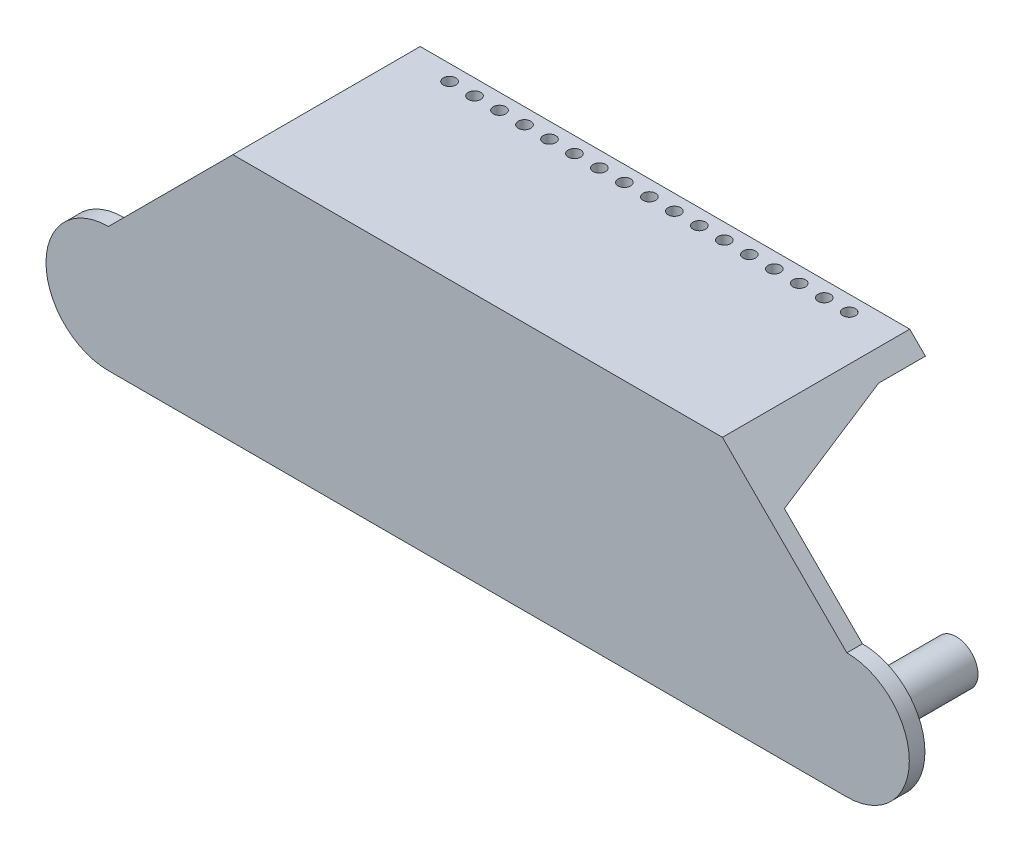
from build123d import *

# Parameters (mm, degrees)
EXTRUDE_1_DEPTH          = 5
SKETCH_2_R               = 7
EXTRUDE_2_DEPTH          = 30
EXTRUDE_3_DEPTH          = 5
EXTRUDE_4_DEPTH          = 55
SKETCH_5_R               = 2
CUT_EXTRUDE_1_DEPTH      = 169.861141178
EXTRUDE_5_DEPTH          = 40
CUT_EXTRUDE_2_DEPTH      = 161.374826578
CUT_EXTRUDE_2_DEPTH_BACK = 161.374826578


with BuildPart() as part:
    # Эскиз1 → Бобышка-Вытянуть1 (new body)
    with BuildSketch(Plane.XY):
        with BuildLine():
            Line((-118.25, -20), (118.25, -20))
            ThreePointArc((118.25, -20), (138.25, 0), (118.25, 20))
            Line((118.25, 20), (-118.25, 20))
            ThreePointArc((-118.25, 20), (-138.25, 0), (-118.25, -20))
        make_face()
    extrude(amount=EXTRUDE_1_DEPTH)

    # Эскиз2 → Бобышка-Вытянуть2 (add)
    with BuildSketch(Plane(origin=(0, 0, 0), x_dir=(-1, 0, 0), z_dir=(0, 0, -1))):
        with Locations(Location((-118.25, 0, 0), (0, 0, 180))):
            Circle(SKETCH_2_R)
        with Locations(Location((118.25, 0, 0), (0, 0, 180))):
            Circle(SKETCH_2_R)
    extrude(amount=EXTRUDE_2_DEPTH)

    # Эскиз3 → Бобышка-Вытянуть3 (add)
    with BuildSketch(Plane.XY.offset(5)):
        Polygon((-118.25, 20), (-78.4, 59.85), (78.4, 59.85), (118.25, 20), align=None)
    extrude(amount=-EXTRUDE_3_DEPTH)

    # Эскиз4 → Бобышка-Вытянуть4 (add)
    with BuildSketch(Plane(origin=(0, 0, 0), x_dir=(-1, 0, 0), z_dir=(0, 0, -1))):
        Polygon((-78.4, 59.85), (-83.4, 54.85), (83.4, 54.85), (78.4, 59.85), align=None)
    extrude(amount=EXTRUDE_4_DEPTH)

    # Эскиз5 → Вырез-Вытянуть1 (cut, through all)
    with BuildSketch(Plane(origin=(0, 59.85, 0), x_dir=(1, 0, 0), z_dir=(0, 1, 0))):
        with Locations(Location((0, 50, 0), (0, 0, 180))):
            Circle(SKETCH_5_R)
        with Locations(Location((8, 50, 0), (0, 0, 180))):
            Circle(SKETCH_5_R)
        with Locations(Location((16, 50, 0), (0, 0, 180))):
            Circle(SKETCH_5_R)
        with Locations(Location((24, 50, 0), (0, 0, 180))):
            Circle(SKETCH_5_R)
        with Locations(Location((32, 50, 0), (0, 0, 180))):
            Circle(SKETCH_5_R)
        with Locations(Location((40, 50, 0), (0, 0, 180))):
            Circle(SKETCH_5_R)
        with Locations(Location((48, 50, 0), (0, 0, 180))):
            Circle(SKETCH_5_R)
        with Locations(Location((56, 50, 0), (0, 0, 180))):
            Circle(SKETCH_5_R)
        with Locations(Location((64, 50, 0), (0, 0, 180))):
            Circle(SKETCH_5_R)
        with Locations(Location((-8, 50, 0), (0, 0, 180))):
            Circle(SKETCH_5_R)
        with Locations(Location((-16, 50, 0), (0, 0, 180))):
            Circle(SKETCH_5_R)
        with Locations(Location((-24, 50, 0), (0, 0, 180))):
            Circle(SKETCH_5_R)
        with Locations(Location((-32, 50, 0), (0, 0, 180))):
            Circle(SKETCH_5_R)
        with Locations(Location((-40, 50, 0), (0, 0, 180))):
            Circle(SKETCH_5_R)
        with Locations(Location((-48, 50, 0), (0, 0, 180))):
            Circle(SKETCH_5_R)
        with Locations(Location((-56, 50, 0), (0, 0, 180))):
            Circle(SKETCH_5_R)
        with Locations(Location((-64, 50, 0), (0, 0, 180))):
            Circle(SKETCH_5_R)
    extrude(amount=-CUT_EXTRUDE_1_DEPTH, mode=Mode.SUBTRACT)

    # Эскиз7 → Бобышка-Вытянуть5 (add)
    with BuildSketch(Plane(origin=(0, 0, 0), x_dir=(-1, 0, 0), z_dir=(0, 0, -1))):
        Polygon((-118.25, 20), (-111.178932188, 20), (-76.04842613, 55.130506058), (-83.4, 54.85), align=None)
        Polygon((83.4, 54.85), (76.328932188, 54.85), (111.178932188, 20), (118.25, 20), align=None)
    extrude(amount=EXTRUDE_5_DEPTH)

    # Эскиз10 → Вырез-Вытянуть2 (cut, two sides: drawn at the far end of the back side and taken through both)
    with BuildSketch(Plane(origin=(0, 0, 0), x_dir=(0, 0, -1), z_dir=(1, 0, 0)).offset(-CUT_EXTRUDE_2_DEPTH_BACK)):
        Polygon((0, 20), (40, 20), (40, 54.85), (0, 45), align=None)
    extrude(amount=CUT_EXTRUDE_2_DEPTH + CUT_EXTRUDE_2_DEPTH_BACK, mode=Mode.SUBTRACT)


solid = part.part
